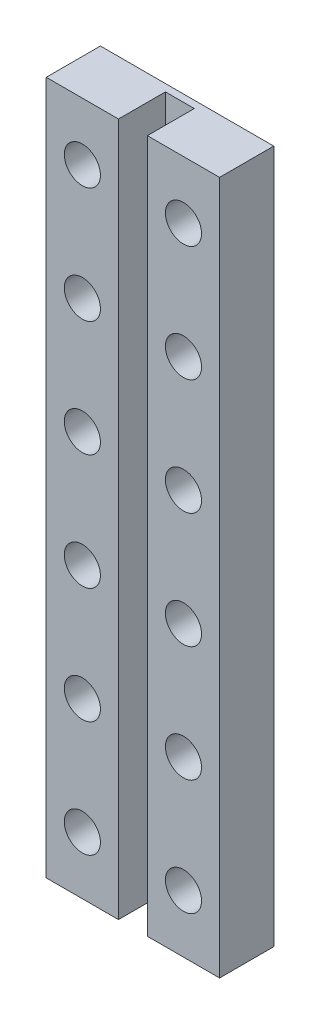
from build123d import *

# Parameters (mm, degrees)
BASE_DEPTH  = 96
ESQUISSE2_R = 2.5
TROU_DEPTH  = 98.037363938


with BuildPart() as part:
    # Esquisse1 → BASE (new body)
    with BuildSketch(Plane(origin=(0, 0, 0), x_dir=(1, 0, 0), z_dir=(0, 1, 0))):
        Polygon((-2, -3.75), (-2, 2.75), (2, 2.75), (2, -3.75), (12, -3.75), (12, 3.75), (-12, 3.75), (-12, -3.75), align=None)
    extrude(amount=-BASE_DEPTH)

    # Esquisse2 → TROU (cut, through all)
    with BuildSketch(Plane.XY.offset(3.75)):
        with Locations((-7, -8)):
            Circle(ESQUISSE2_R)
        with Locations((7, -8)):
            Circle(ESQUISSE2_R)
        with Locations((7, -24)):
            Circle(ESQUISSE2_R)
        with Locations((7, -40)):
            Circle(ESQUISSE2_R)
        with Locations((7, -56)):
            Circle(ESQUISSE2_R)
        with Locations((7, -72)):
            Circle(ESQUISSE2_R)
        with Locations((7, -88)):
            Circle(ESQUISSE2_R)
        with Locations((-7, -24)):
            Circle(ESQUISSE2_R)
        with Locations((-7, -40)):
            Circle(ESQUISSE2_R)
        with Locations((-7, -56)):
            Circle(ESQUISSE2_R)
        with Locations((-7, -72)):
            Circle(ESQUISSE2_R)
        with Locations((-7, -88)):
            Circle(ESQUISSE2_R)
    extrude(amount=-TROU_DEPTH, mode=Mode.SUBTRACT)


solid = part.part
